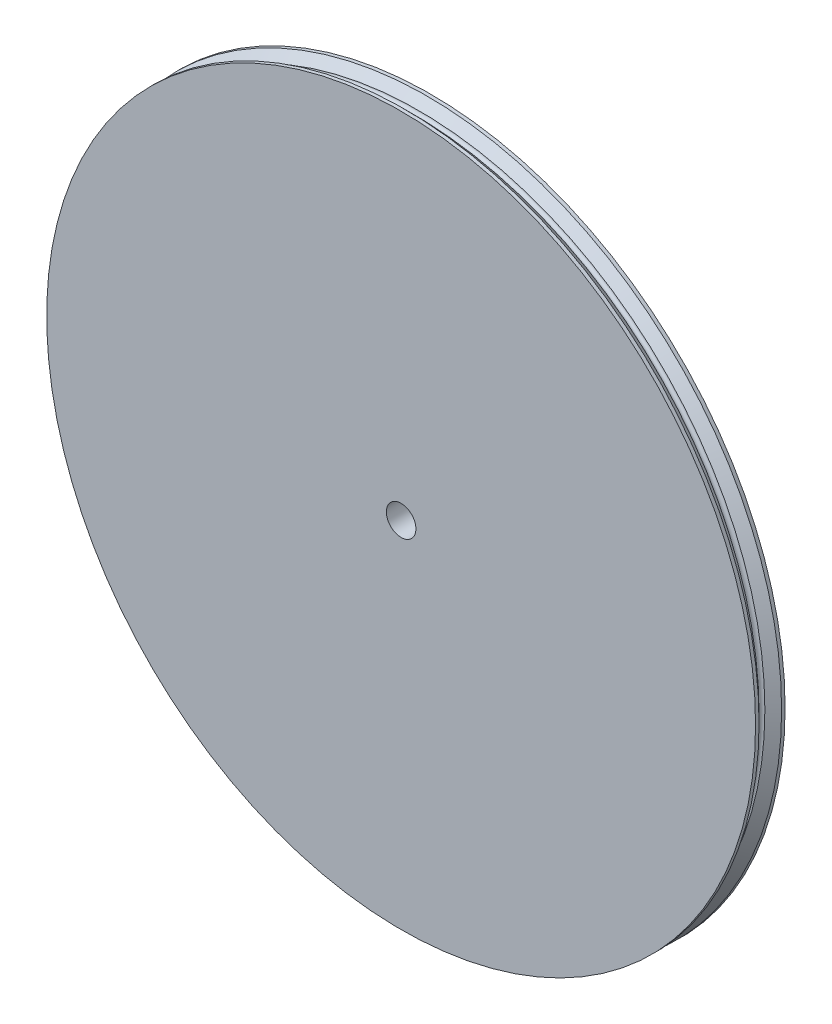
from build123d import *


with BuildPart() as part:
    # Sketch1 → Revolve1 (revolve)
    with BuildSketch(Plane(origin=(0, 0, 0), x_dir=(1, 0, 0), z_dir=(0, 1, 0))):
        with BuildLine():
            Line((6.35, 6.35), (152.4, 6.35))
            Line((152.4, 6.35), (152.4, 4.85))
            Line((152.4, 4.85), (148.8, 1.25))
            ThreePointArc((148.8, 1.25), (147.55, 0), (148.8, -1.25))
            Line((148.8, -1.25), (152.4, -4.85))
            Line((152.4, -4.85), (152.4, -6.35))
            Line((152.4, -6.35), (6.35, -6.35))
            Line((6.35, -6.35), (6.35, 6.35))
        make_face()
    revolve(axis=Axis((0, 0, 6.35), (0, 0, -1)))


solid = part.part
